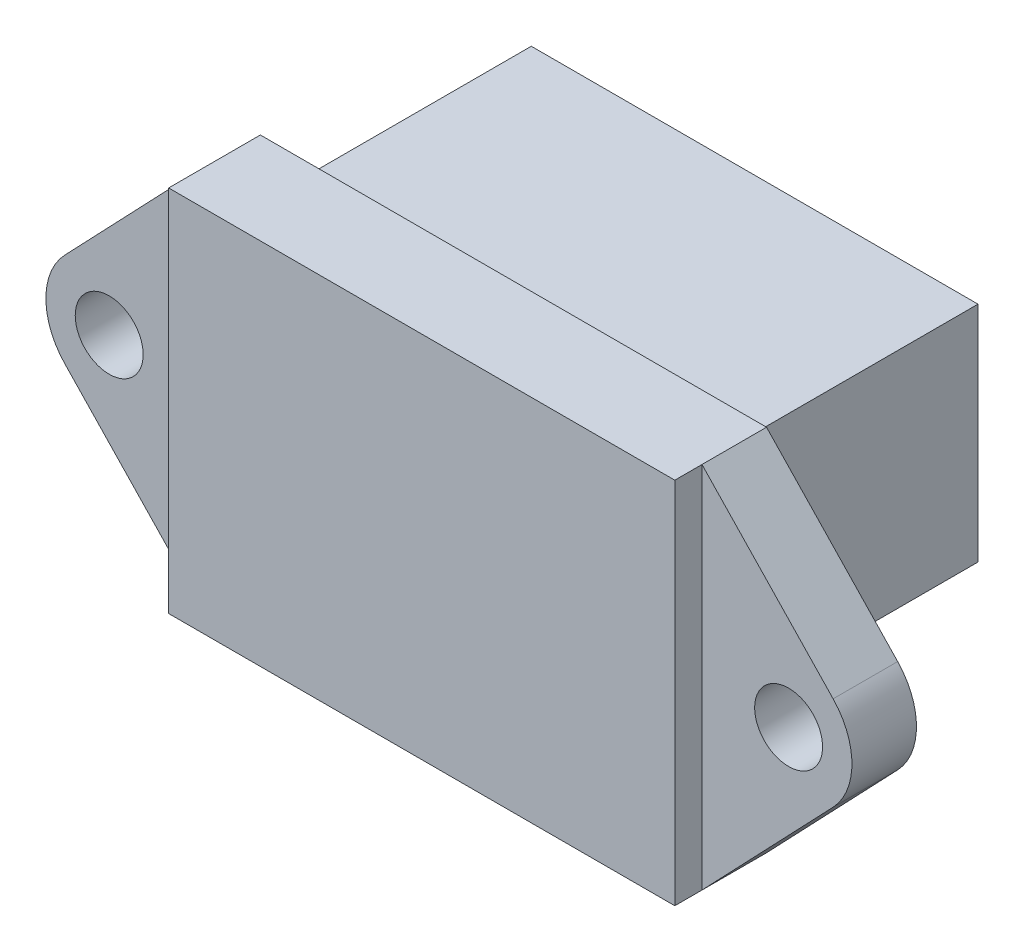
from build123d import *

# Parameters (mm, degrees)
SKETCH1_W           = 29.8
SKETCH1_H           = 21.7
BOSS_EXTRUDE1_DEPTH = 5.4
SKETCH2_R           = 2
BOSS_EXTRUDE2_DEPTH = 3.8
FILLET1_R           = 4
BOSS_EXTRUDE3_DEPTH = 14.2


with BuildPart() as part:
    # Sketch1 → Boss-Extrude1 (new body)
    with BuildSketch(Plane.XY):
        Rectangle(SKETCH1_W, SKETCH1_H)
    extrude(amount=BOSS_EXTRUDE1_DEPTH)

    # Sketch2 → Boss-Extrude2 (add)
    # profile 1 of 2: a face of its own
    with BuildSketch(Plane.XY):
        Polygon((14.9, 10.85), (14.9, -10.85), (25.257485216, 0), align=None)
        with Locations(Location((20, 0, 0), (0, 0, 180))):
            Circle(SKETCH2_R, mode=Mode.SUBTRACT)
    # profile 2 of 2: a face of its own
    with BuildSketch(Plane.XY):
        Polygon((-14.9, 10.85), (-14.9, -10.85), (-25.257485216, 0), align=None)
        with Locations(Location((-20, 0, 0), (0, 0, 180))):
            Circle(SKETCH2_R, mode=Mode.SUBTRACT)
    extrude(amount=BOSS_EXTRUDE2_DEPTH)

    # Fillet1
    fillet1_edges = [part.edges().sort_by_distance(p)[0] for p in [
        (25.257485216, 0, 1.9),
        (-25.257485216, 0, 1.9),
    ]]
    fillet(fillet1_edges, radius=FILLET1_R)

    # Sketch3 → Boss-Extrude3 (add)
    with BuildSketch(Plane(origin=(0, 0, 0), x_dir=(-1, 0, 0), z_dir=(0, 0, -1))):
        Polygon((-13.15, 9.15), (13.15, 9.15), (13.15, -4), (8, -9.15), (-8, -9.15), (-13.15, -4), align=None)
    extrude(amount=BOSS_EXTRUDE3_DEPTH)


solid = part.part
